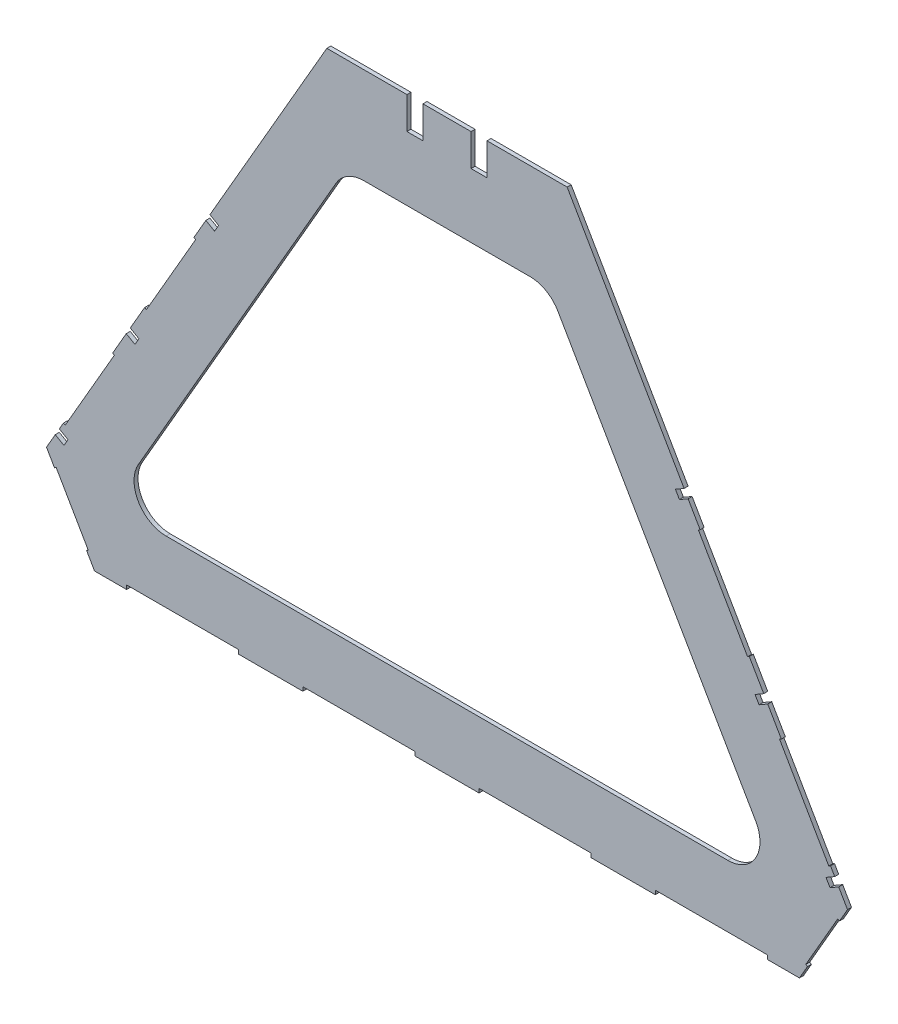
from build123d import *

# Parameters (mm, degrees)
BOSS_EXTRUDE1_DEPTH = 3.175
SKETCH2_W           = 12.7
SKETCH2_H           = 25.4
CUT_EXTRUDE1_DEPTH  = 612.325617511
SKETCH4_W           = 88.9
SKETCH4_H           = 3.175
CUT_EXTRUDE2_DEPTH  = 612.325617511
CUT_EXTRUDE3_DEPTH  = 612.325617511
CUT_EXTRUDE4_DEPTH  = 612.325617511


with BuildPart() as part:
    # Sketch1 → Boss-Extrude1 (new body)
    with BuildSketch(Plane.XY):
        Polygon((0, 0), (190.5, 0), (412.75, -384.948291982), (374.65, -450.939427751), (-184.15, -450.939427751), (-222.25, -384.948291982), align=None)
    extrude(amount=BOSS_EXTRUDE1_DEPTH)

    # Sketch2 → Cut-Extrude1 (cut, through all)
    with BuildSketch(Plane.XY.offset(3.175)):
        with Locations((69.85, -12.7)):
            Rectangle(SKETCH2_W, SKETCH2_H)
        with BuildLine():
            Line((29.329393675, -76.2), (161.170606325, -76.2))
            ThreePointArc((161.170606325, -76.2), (173.870606325, -79.602954744), (183.167651581, -88.9))
            Line((183.167651581, -88.9), (339.952954744, -360.460110958))
            ThreePointArc((339.952954744, -360.460110958), (339.952954744, -385.860110958), (317.955909488, -398.560110958))
            Line((317.955909488, -398.560110958), (-127.455909488, -398.560110958))
            ThreePointArc((-127.455909488, -398.560110958), (-149.452954744, -385.860110958), (-149.452954744, -360.460110958))
            Line((-149.452954744, -360.460110958), (7.332348419, -88.9))
            ThreePointArc((7.332348419, -88.9), (16.629393675, -79.602954744), (29.329393675, -76.2))
        make_face()
        with Locations((120.65, -12.7)):
            Rectangle(SKETCH2_W, SKETCH2_H)
    extrude(amount=-CUT_EXTRUDE1_DEPTH, mode=Mode.SUBTRACT)

    # Sketch4 → Cut-Extrude2 (cut, through all)
    with BuildSketch(Plane.XY.offset(3.175)):
        with Locations((-114.3, -449.351927751)):
            Rectangle(SKETCH4_W, SKETCH4_H)
        with Locations((25.4, -449.351927751)):
            Rectangle(SKETCH4_W, SKETCH4_H)
        with Locations((165.1, -449.351927751)):
            Rectangle(SKETCH4_W, SKETCH4_H)
        with Locations((304.8, -449.351927751)):
            Rectangle(SKETCH4_W, SKETCH4_H)
        Polygon((-215.9, -395.94681461), (-214.525184671, -395.15306461), (-189.125184671, -439.147155122), (-190.5, -439.940905122), align=None)
        Polygon((406.4, -395.94681461), (405.025184671, -395.15306461), (379.625184671, -439.147155122), (381, -439.940905122), align=None)
    extrude(amount=-CUT_EXTRUDE2_DEPTH, mode=Mode.SUBTRACT)

    # Sketch5 → Cut-Extrude3 (cut, through all)
    with BuildSketch(Plane.XY.offset(3.175)):
        Polygon((-208.788, -361.631424011), (-207.413184671, -362.425174011), (-168.424184671, -294.894245074), (-169.799, -294.100495074), align=None)
        Polygon((-143.024184671, -250.900154562), (-104.035184671, -183.369225626), (-105.41, -182.575475626), (-144.399, -250.106404562), align=None)
        Polygon((399.288, -361.631424011), (397.913184671, -362.425174011), (358.924184671, -294.894245074), (360.299, -294.100495074), align=None)
        Polygon((334.899, -250.106404562), (333.524184671, -250.900154562), (294.535184671, -183.369225626), (295.91, -182.575475626), align=None)
    extrude(amount=-CUT_EXTRUDE3_DEPTH, mode=Mode.SUBTRACT)

    # Sketch6 → Cut-Extrude4 (cut, through all)
    with BuildSketch(Plane.XY.offset(3.175)):
        Polygon((-155.829, -269.903745293), (-148.954923357, -273.872495293), (-152.129923357, -279.371756607), (-159.004, -275.403006607), align=None)
        Polygon((349.504, -275.403006607), (346.329, -269.903745293), (339.454923357, -273.872495293), (342.629923357, -279.371756607), align=None)
        Polygon((-205.215923357, -371.319405777), (-208.390923357, -376.818667091), (-215.265, -372.849917091), (-212.09, -367.350655777), align=None)
        Polygon((-85.835923357, -164.54718037), (-89.010923357, -170.046441684), (-95.885, -166.077691684), (-92.71, -160.57843037), align=None)
        Polygon((286.385, -166.077691684), (283.21, -160.57843037), (276.335923357, -164.54718037), (279.510923357, -170.046441684), align=None)
        Polygon((405.765, -372.849917091), (402.59, -367.350655777), (395.715923357, -371.319405777), (398.890923357, -376.818667091), align=None)
    extrude(amount=-CUT_EXTRUDE4_DEPTH, mode=Mode.SUBTRACT)


solid = part.part
